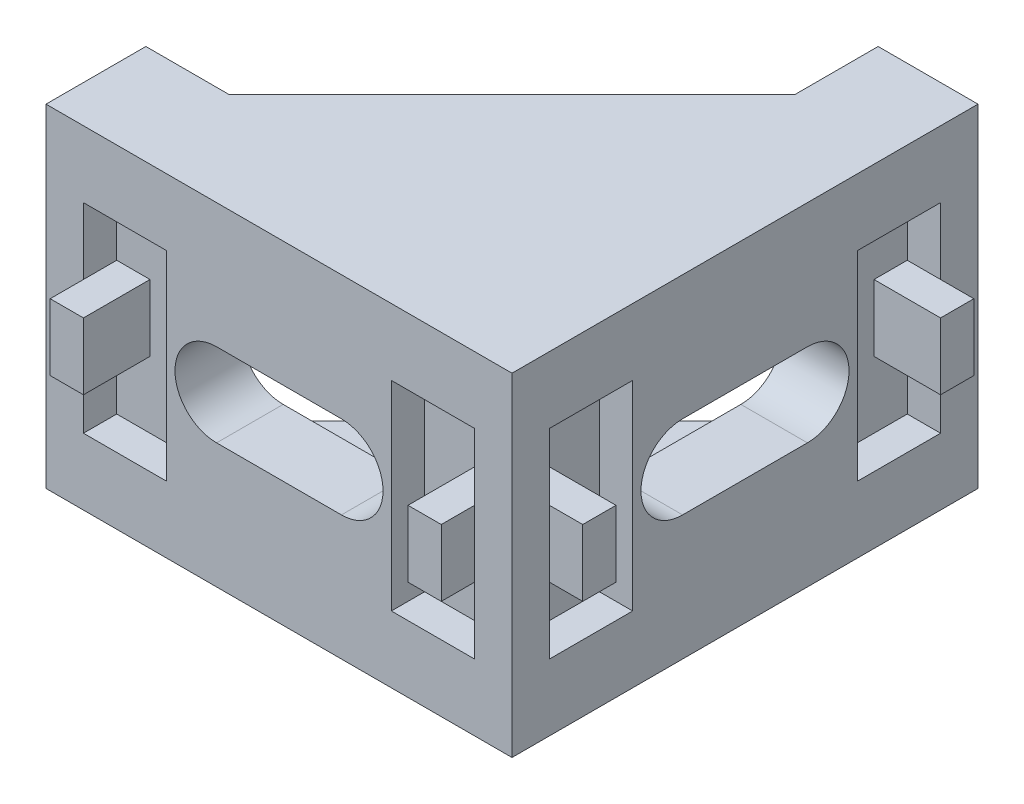
from build123d import *

# Parameters (mm, degrees)
BOSS_EXTRUDE1_DEPTH = 20
SKETCH2_W           = 24
SKETCH2_H           = 14
CUT_EXTRUDE1_DEPTH  = 24
SKETCH3_W           = 5
SKETCH3_H           = 12
CUT_EXTRUDE2_DEPTH  = 2
SKETCH4_W           = 2
SKETCH4_H           = 4
BOSS_EXTRUDE2_DEPTH = 4
CUT_EXTRUDE3_REACH  = 43.952


with BuildPart() as part:
    # Sketch1 → Boss-Extrude1 (new body)
    with BuildSketch(Plane(origin=(0, 0, 0), x_dir=(1, 0, 0), z_dir=(0, 1, 0))):
        Polygon((-28, 0), (0, 0), (0, 28), (-6, 28), (-6, 23), (-23, 6), (-28, 6), align=None)
    extrude(amount=BOSS_EXTRUDE1_DEPTH)

    # Sketch2 → Cut-Extrude1 (cut)
    with BuildSketch(Plane(origin=(0, 0, -28), x_dir=(-1, 0, 0), z_dir=(0, 0, -1))):
        with Locations((16, 10)):
            Rectangle(SKETCH2_W, SKETCH2_H)
    extrude(amount=-CUT_EXTRUDE1_DEPTH, mode=Mode.SUBTRACT)

    # Sketch3 → Cut-Extrude2 (cut)
    with BuildSketch(Plane.XY):
        with Locations((-23.25, 10)):
            Rectangle(SKETCH3_W, SKETCH3_H)
        with Locations((-4.75, 10)):
            Rectangle(SKETCH3_W, SKETCH3_H)
    cut_extrude2 = extrude(amount=-CUT_EXTRUDE2_DEPTH, mode=Mode.SUBTRACT)

    # Sketch4 → Boss-Extrude2 (add)
    with BuildSketch(Plane.XY.offset(-2)):
        with Locations((-24.75, 10)):
            Rectangle(SKETCH4_W, SKETCH4_H)
        with Locations((-3.25, 10)):
            Rectangle(SKETCH4_W, SKETCH4_H)
    boss_extrude2 = extrude(amount=BOSS_EXTRUDE2_DEPTH)

    # Mirror11: Cut-Extrude2, Boss-Extrude2 across plane
    add(cut_extrude2.mirror(Plane(origin=(0, 0, 0), x_dir=(0.7071067811865478, 0, 0.7071067811865472), z_dir=(-0.7071067811865475, 0, 0.7071067811865477))), mode=Mode.SUBTRACT)
    add(boss_extrude2.mirror(Plane(origin=(0, 0, 0), x_dir=(0.7071067811865478, 0, 0.7071067811865472), z_dir=(-0.7071067811865475, 0, 0.7071067811865477))))

    # Sketch5 → Cut-Extrude3 (cut, up to next)
    with BuildSketch(Plane(origin=(0, 0, -4), x_dir=(-1, 0, 0), z_dir=(0, 0, -1)), mode=Mode.PRIVATE) as cut_extrude3_sk1:
        with BuildLine():
            Line((10.25, 12.5), (17.75, 12.5))
            ThreePointArc((17.75, 12.5), (20.25, 10), (17.75, 7.5))
            Line((17.75, 7.5), (10.25, 7.5))
            ThreePointArc((10.25, 7.5), (7.75, 10), (10.25, 12.5))
        make_face()
    cut_extrude3_tool1 = extrude(cut_extrude3_sk1.sketch, amount=-CUT_EXTRUDE3_REACH, mode=Mode.PRIVATE) & part.part
    cut_extrude3 = cut_extrude3_tool1.solids().sort_by_distance((-14, 10, -4))[0]
    add(cut_extrude3, mode=Mode.SUBTRACT)

    # Mirror12: Cut-Extrude3 across plane
    add(cut_extrude3.mirror(Plane(origin=(0, 0, 0), x_dir=(0.7071067811865478, 0, 0.7071067811865472), z_dir=(-0.7071067811865475, 0, 0.7071067811865477))), mode=Mode.SUBTRACT)


solid = part.part
